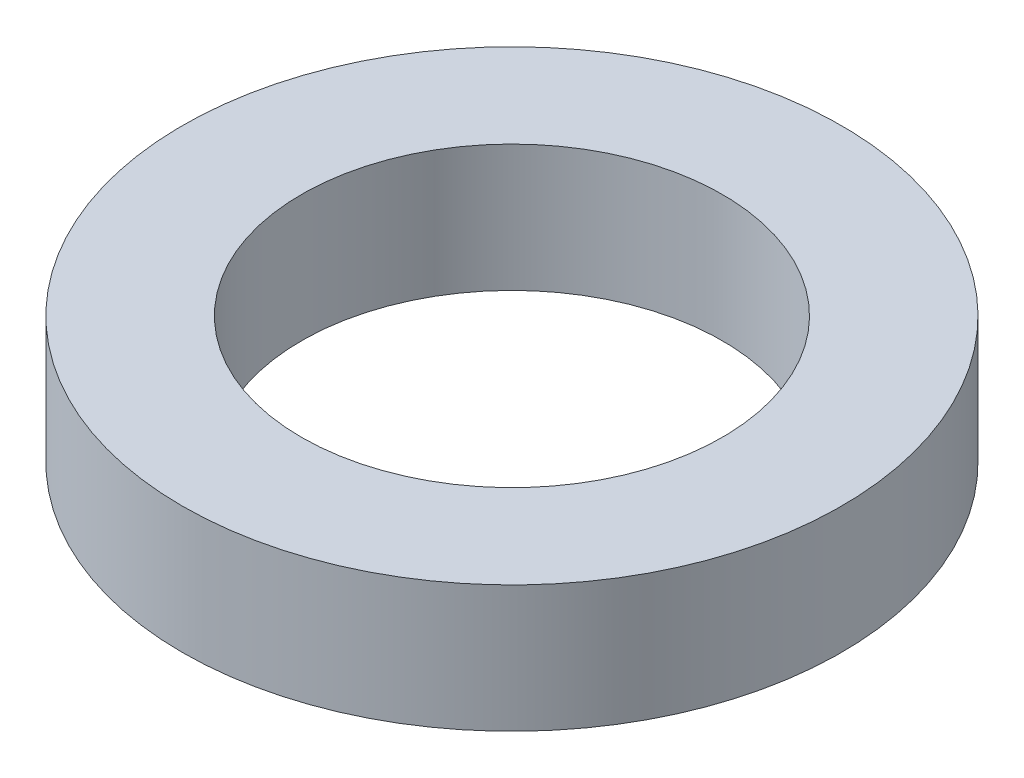
from build123d import *

# Parameters (mm, degrees)
SKETCH1_W = 2.35
SKETCH1_H = 2.5


with BuildPart() as part:
    # Sketch1 → Revolve1 (revolve)
    with BuildSketch(Plane.XY, mode=Mode.PRIVATE) as revolve1_sk:
        with Locations((-5.325, 1.25)):
            Rectangle(SKETCH1_W, SKETCH1_H)
    revolve(revolve1_sk.sketch.rotate(Axis((0, 0, 0), (0, -1, 0)), 270), axis=Axis((0, 0, 0), (0, -1, 0)))


solid = part.part
